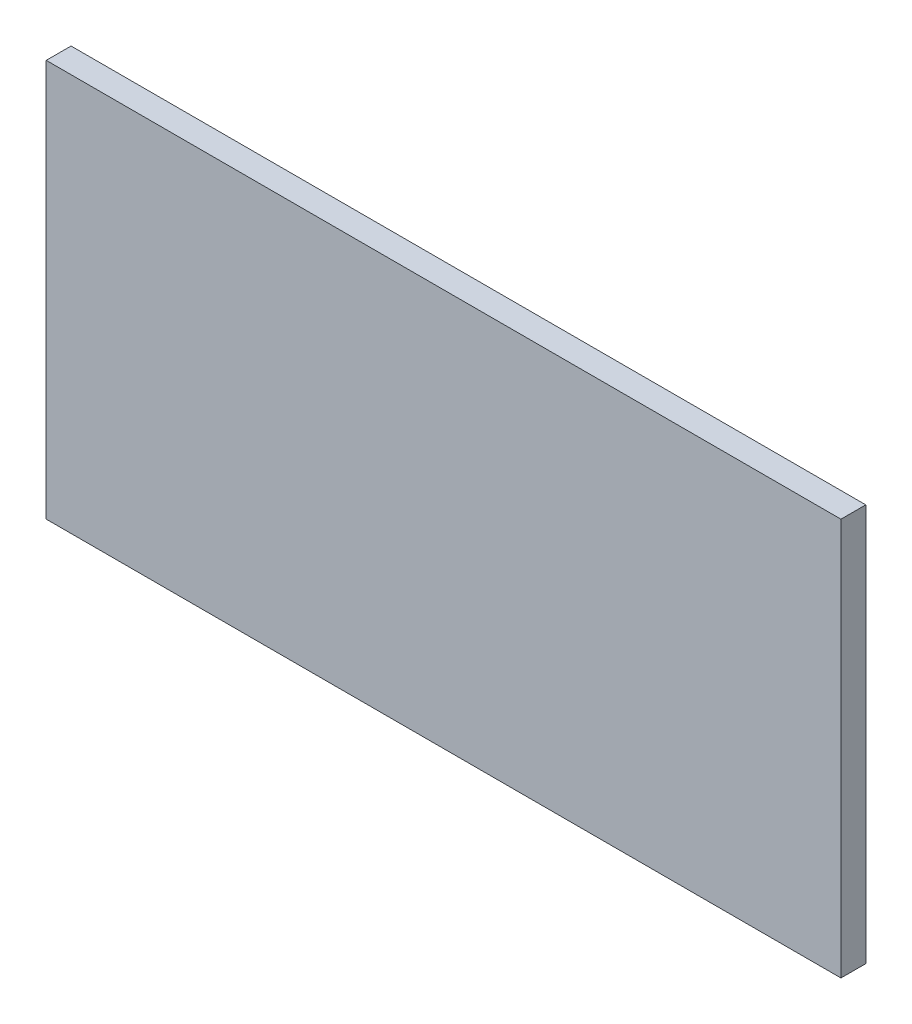
from build123d import *

# Parameters (mm, degrees)
CROQUIS1_W              = 80
CROQUIS1_H              = 40
SALIENTE_EXTRUIR1_DEPTH = 2.5


with BuildPart() as part:
    # Croquis1 → Saliente-Extruir1 (new body)
    with BuildSketch(Plane.XY):
        Rectangle(CROQUIS1_W, CROQUIS1_H)
    extrude(amount=SALIENTE_EXTRUIR1_DEPTH)


solid = part.part
